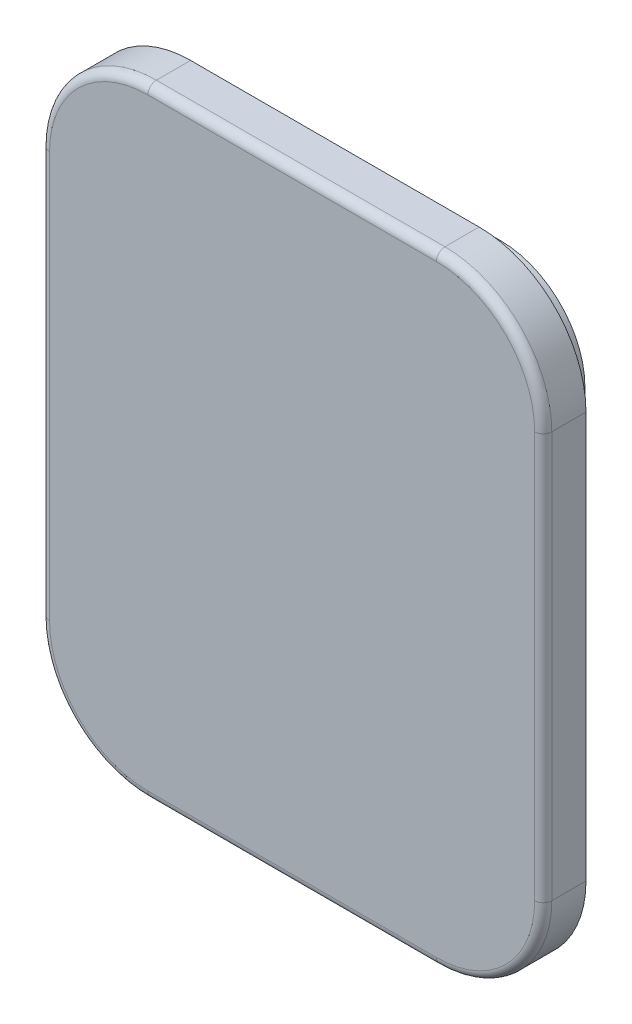
from build123d import *

# Parameters (mm, degrees)
LOWER_MATING_LIP_OUTER_2MM_OVERLAP_DEPTH       = 2
LOWER_MATING_LIP_INNER_CLEARANCE_DEPTH         = 2.3
LOWER_VISIBLE_BASE_4MM_DEPTH                   = 4
LOWER_BOTTOM_EDGE_SOFT_FILLET_R0_8_R           = 0.8
LOWER_USB_C_RIGHT_SIDE_LIP_CLEARANCE_AT_DEPTH  = 1.3
SKETCH_7_R                                     = 2.1
LOWER_PCB1_LOCATING_1_RIGHT_TOP_POST_BAS_DEPTH = 0.8
SKETCH_8_R                                     = 1.3
LOWER_PCB1_LOCATING_1_RIGHT_TOP_SOLID_PO_DEPTH = 2.5
LOWER_PCB1_LOCATING_1_RIGHT_TOP_SOLI_2_R       = 0.2
SKETCH_9_R                                     = 2.1
LOWER_PCB1_LOCATING_2_RIGHT_BOTTOM_POST_DEPTH  = 0.8
SKETCH_10_R                                    = 1.3
LOWER_PCB1_LOCATING_2_RIGHT_BOTTOM_SOLID_DEPTH = 2.5
LOWER_PCB1_LOCATING_2_RIGHT_BOTTOM_S_2_R       = 0.2
SKETCH_11_R                                    = 2.1
LOWER_PCB1_LOCATING_3_LEFT_TOP_POST_BASE_DEPTH = 0.8
SKETCH_12_R                                    = 1.3
LOWER_PCB1_LOCATING_3_LEFT_TOP_SOLID_POS_DEPTH = 2.5
LOWER_PCB1_LOCATING_3_LEFT_TOP_SOLID_2_R       = 0.2
LOWER_LANYARD_WET_ZONE_LEFT_OUTER_WINDOW_DEPTH = 1.45
LOWER_LANYARD_WET_ZONE_RIGHT_OUTER_WINDO_DEPTH = 1.45
SKETCH_16_W                                    = 31
SKETCH_16_H                                    = 0.7
LOWER_LANYARD_DRY_ZONE_SEAL_RIB_TOP_V7_DEPTH   = 1.6
SKETCH_17_W                                    = 0.7
SKETCH_17_H                                    = 4.2
LOWER_LANYARD_DRY_ZONE_SEAL_RIB_LEFT_V7_DEPTH  = 1.6
SKETCH_18_W                                    = 0.7
SKETCH_18_H                                    = 4.2
LOWER_LANYARD_DRY_ZONE_SEAL_RIB_RIGHT_V7_DEPTH = 1.6


with BuildPart() as part:
    # 草图1 → Lower_mating_lip_outer_2mm_overlap (new body)
    with BuildSketch(Plane.XY):
        with BuildLine():
            Line((-13.5, 26.9), (13.5, 26.9))
            ThreePointArc((13.5, 26.9), (19.086143571, 24.586143571), (21.4, 19))
            Line((21.4, 19), (21.4, -19))
            ThreePointArc((21.4, -19), (19.086143571, -24.586143571), (13.5, -26.9))
            Line((13.5, -26.9), (-13.5, -26.9))
            ThreePointArc((-13.5, -26.9), (-19.086143571, -24.586143571), (-21.4, -19))
            Line((-21.4, -19), (-21.4, 19))
            ThreePointArc((-21.4, 19), (-19.086143571, 24.586143571), (-13.5, 26.9))
        make_face()
    extrude(amount=LOWER_MATING_LIP_OUTER_2MM_OVERLAP_DEPTH)

    # 草图2 → Lower_mating_lip_inner_clearance (cut)
    with BuildSketch(Plane.XY):
        with BuildLine():
            Line((-12.6, 24.9), (12.6, 24.9))
            ThreePointArc((12.6, 24.9), (17.408326112, 22.908326112), (19.4, 18.1))
            Line((19.4, 18.1), (19.4, -18.1))
            ThreePointArc((19.4, -18.1), (17.408326112, -22.908326112), (12.6, -24.9))
            Line((12.6, -24.9), (-12.6, -24.9))
            ThreePointArc((-12.6, -24.9), (-17.408326112, -22.908326112), (-19.4, -18.1))
            Line((-19.4, -18.1), (-19.4, 18.1))
            ThreePointArc((-19.4, 18.1), (-17.408326112, 22.908326112), (-12.6, 24.9))
        make_face()
    extrude(amount=LOWER_MATING_LIP_INNER_CLEARANCE_DEPTH, mode=Mode.SUBTRACT)

    # 草图3 → Lower_visible_base_4mm (add)
    with BuildSketch(Plane.XY.offset(2)):
        with BuildLine():
            Line((-13.5, 29), (13.5, 29))
            ThreePointArc((13.5, 29), (20.571067812, 26.071067812), (23.5, 19))
            Line((23.5, 19), (23.5, -19))
            ThreePointArc((23.5, -19), (20.571067812, -26.071067812), (13.5, -29))
            Line((13.5, -29), (-13.5, -29))
            ThreePointArc((-13.5, -29), (-20.571067812, -26.071067812), (-23.5, -19))
            Line((-23.5, -19), (-23.5, 19))
            ThreePointArc((-23.5, 19), (-20.571067812, 26.071067812), (-13.5, 29))
        make_face()
    extrude(amount=LOWER_VISIBLE_BASE_4MM_DEPTH)

    # Lower_bottom_edge_soft_fillet_r0_8
    lower_bottom_edge_soft_fillet_r0_8_edges = [part.edges().sort_by_distance(p)[0] for p in [
        (-20.571067812, 26.071067812, 6),
        (-23.5, 0, 6),
        (-20.571067812, -26.071067812, 6),
        (0, -29, 6),
        (20.571067812, -26.071067812, 6),
        (23.5, 0, 6),
        (20.571067812, 26.071067812, 6),
        (0, 29, 6),
    ]]
    fillet(lower_bottom_edge_soft_fillet_r0_8_edges, radius=LOWER_BOTTOM_EDGE_SOFT_FILLET_R0_8_R)

    # 草图6 → Lower_USB_C_right_side_lip_clearance_at (cut)
    with BuildSketch(Plane.XY):
        with BuildLine():
            Line((18.2, 13.5045794), (20.2, 13.5045794))
            ThreePointArc((20.2, 13.5045794), (21.048528137, 13.153107537), (21.4, 12.3045794))
            Line((21.4, 12.3045794), (21.4, 5.7045794))
            ThreePointArc((21.4, 5.7045794), (21.048528137, 4.856051263), (20.2, 4.5045794))
            Line((20.2, 4.5045794), (18.2, 4.5045794))
            ThreePointArc((18.2, 4.5045794), (17.351471863, 4.856051263), (17, 5.7045794))
            Line((17, 5.7045794), (17, 12.3045794))
            ThreePointArc((17, 12.3045794), (17.351471863, 13.153107537), (18.2, 13.5045794))
        make_face()
    extrude(amount=LOWER_USB_C_RIGHT_SIDE_LIP_CLEARANCE_AT_DEPTH, mode=Mode.SUBTRACT)



with BuildPart() as body_2:
    # 草图7 → Lower_PCB1_locating_1_right_top_post_base_pad_d4_2_h0_8 (new body)
    with BuildSketch(Plane.XY):
        with Locations((16.2726751, 17.2936916)):
            Circle(SKETCH_7_R)
    extrude(amount=LOWER_PCB1_LOCATING_1_RIGHT_TOP_POST_BAS_DEPTH)


with BuildPart() as part_1:
    add(part.part)

    add(body_2.part)  # Lower_PCB1_locating_1_right_top_solid_po merges body 2
    # 草图8 → Lower_PCB1_locating_1_right_top_solid_po (add)
    with BuildSketch(Plane.XY):
        with Locations(Location((16.2726751, 17.2936916, 0), (0, 0, 180))):
            Circle(SKETCH_8_R)
    extrude(amount=LOWER_PCB1_LOCATING_1_RIGHT_TOP_SOLID_PO_DEPTH)

    # Lower_PCB1_locating_1_right_top_soli 2
    lower_pcb1_locating_1_right_top_soli_2_edges = [part_1.edges().sort_by_distance(p)[0] for p in [
        (14.1726751, 17.2936916, 0),
    ]]
    fillet(lower_pcb1_locating_1_right_top_soli_2_edges, radius=LOWER_PCB1_LOCATING_1_RIGHT_TOP_SOLI_2_R)



with BuildPart() as body_2_2:
    # 草图9 → Lower_PCB1_locating_2_right_bottom_post_base_pad_d4_2_h0_8 (new body)
    with BuildSketch(Plane.XY):
        with Locations((16.1290889, -17.4727108)):
            Circle(SKETCH_9_R)
    extrude(amount=LOWER_PCB1_LOCATING_2_RIGHT_BOTTOM_POST_DEPTH)


with BuildPart() as part_2:
    add(part_1.part)

    add(body_2_2.part)  # Lower_PCB1_locating_2_right_bottom_solid merges body 2 2
    # 草图10 → Lower_PCB1_locating_2_right_bottom_solid (add)
    with BuildSketch(Plane.XY):
        with Locations(Location((16.1290889, -17.4727108, 0), (0, 0, 180))):
            Circle(SKETCH_10_R)
    extrude(amount=LOWER_PCB1_LOCATING_2_RIGHT_BOTTOM_SOLID_DEPTH)

    # Lower_PCB1_locating_2_right_bottom_s 2
    lower_pcb1_locating_2_right_bottom_s_2_edges = [part_2.edges().sort_by_distance(p)[0] for p in [
        (14.0290889, -17.4727108, 0),
    ]]
    fillet(lower_pcb1_locating_2_right_bottom_s_2_edges, radius=LOWER_PCB1_LOCATING_2_RIGHT_BOTTOM_S_2_R)



with BuildPart() as body_2_3:
    # 草图11 → Lower_PCB1_locating_3_left_top_post_base_pad_d4_2_h0_8 (new body)
    with BuildSketch(Plane.XY):
        with Locations((-16.5977697, 17.4909226)):
            Circle(SKETCH_11_R)
    extrude(amount=LOWER_PCB1_LOCATING_3_LEFT_TOP_POST_BASE_DEPTH)


with BuildPart() as part_3:
    add(part_2.part)

    add(body_2_3.part)  # Lower_PCB1_locating_3_left_top_solid_pos merges body 2 3
    # 草图12 → Lower_PCB1_locating_3_left_top_solid_pos (add)
    with BuildSketch(Plane.XY):
        with Locations(Location((-16.5977697, 17.4909226, 0), (0, 0, 180))):
            Circle(SKETCH_12_R)
    extrude(amount=LOWER_PCB1_LOCATING_3_LEFT_TOP_SOLID_POS_DEPTH)

    # Lower_PCB1_locating_3_left_top_solid 2
    lower_pcb1_locating_3_left_top_solid_2_edges = [part_3.edges().sort_by_distance(p)[0] for p in [
        (-18.6977697, 17.4909226, 0),
    ]]
    fillet(lower_pcb1_locating_3_left_top_solid_2_edges, radius=LOWER_PCB1_LOCATING_3_LEFT_TOP_SOLID_2_R)

    # 草图14 → Lower_lanyard_wet_zone_left_outer_window_v7_lip1mm (cut)
    with BuildSketch(Plane.XY):
        with BuildLine():
            Line((-12.5, -25), (-3, -25))
            ThreePointArc((-3, -25), (-1.5, -26.5), (-3, -28))
            Line((-3, -28), (-12.5, -28))
            ThreePointArc((-12.5, -28), (-14, -26.5), (-12.5, -25))
        make_face()
    extrude(amount=LOWER_LANYARD_WET_ZONE_LEFT_OUTER_WINDOW_DEPTH, mode=Mode.SUBTRACT)

    # 草图15 → Lower_lanyard_wet_zone_right_outer_window_v7_lip1mm (cut)
    with BuildSketch(Plane.XY):
        with BuildLine():
            Line((3, -25), (12.5, -25))
            ThreePointArc((12.5, -25), (14, -26.5), (12.5, -28))
            Line((12.5, -28), (3, -28))
            ThreePointArc((3, -28), (1.5, -26.5), (3, -25))
        make_face()
    extrude(amount=LOWER_LANYARD_WET_ZONE_RIGHT_OUTER_WINDO_DEPTH, mode=Mode.SUBTRACT)


with BuildPart() as body_2_4:
    # 草图16 → Lower_lanyard_dry_zone_seal_rib_top_v7 (new body)
    with BuildSketch(Plane.XY):
        with Locations((0, -23.9)):
            Rectangle(SKETCH_16_W, SKETCH_16_H)
    extrude(amount=LOWER_LANYARD_DRY_ZONE_SEAL_RIB_TOP_V7_DEPTH)


with BuildPart() as body_3:
    # 草图17 → Lower_lanyard_dry_zone_seal_rib_left_v7 (new body)
    with BuildSketch(Plane.XY):
        with Locations((-15.5, -26.5)):
            Rectangle(SKETCH_17_W, SKETCH_17_H)
    extrude(amount=LOWER_LANYARD_DRY_ZONE_SEAL_RIB_LEFT_V7_DEPTH)


with BuildPart() as body_4:
    # 草图18 → Lower_lanyard_dry_zone_seal_rib_right_v7 (new body)
    with BuildSketch(Plane.XY):
        with Locations((15.5, -26.5)):
            Rectangle(SKETCH_18_W, SKETCH_18_H)
    extrude(amount=LOWER_LANYARD_DRY_ZONE_SEAL_RIB_RIGHT_V7_DEPTH)


solid = Compound([part_3.part, body_2_4.part, body_3.part, body_4.part])
